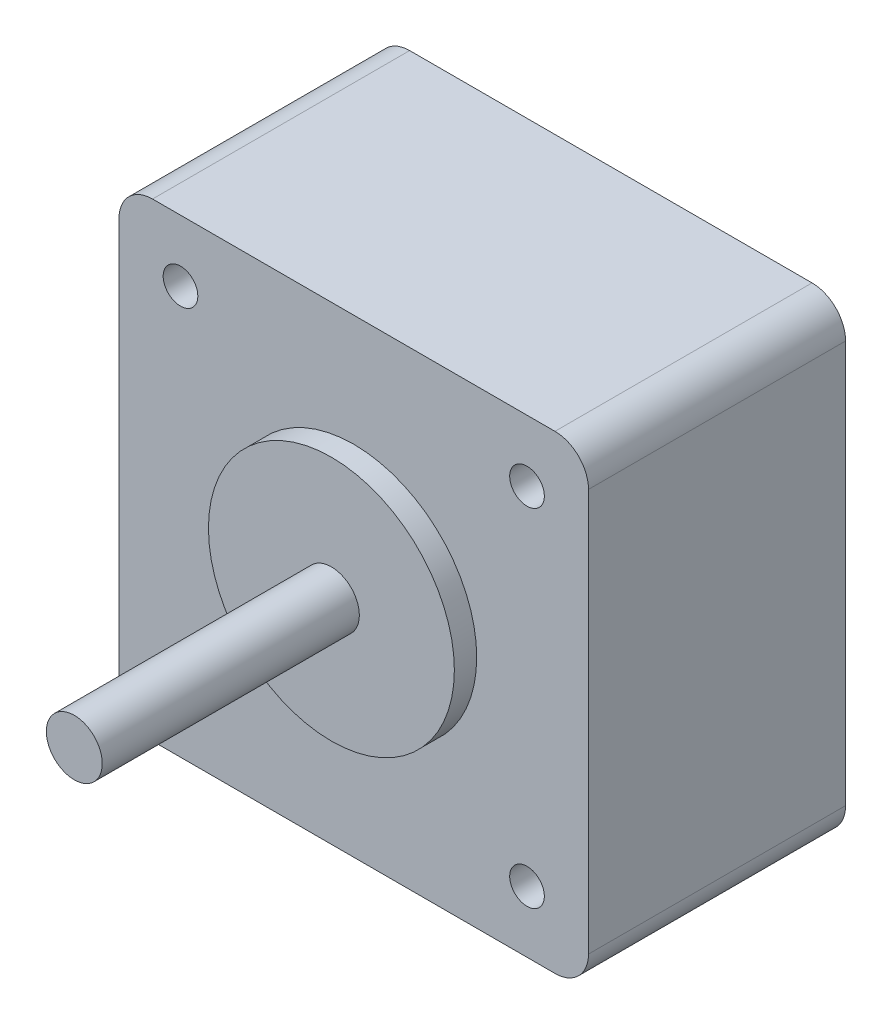
from build123d import *

# Parameters (mm, degrees)
EXTRUDE_1_DEPTH     = 23
SKETCH_2_R          = 11
EXTRUDE_2_DEPTH     = 2
SKETCH_3_R          = 2.5
EXTRUDE_3_DEPTH     = 23
SKETCH_4_R          = 1.55
CUT_EXTRUDE_1_DEPTH = 5


with BuildPart() as part:
    # 草图1 → 凸台-拉伸1 (new body)
    with BuildSketch(Plane.XY):
        with BuildLine():
            Line((-18, 21), (18, 21))
            ThreePointArc((18, 21), (20.121320344, 20.121320344), (21, 18))
            Line((21, 18), (21, -18))
            ThreePointArc((21, -18), (20.121320344, -20.121320344), (18, -21))
            Line((18, -21), (-18, -21))
            ThreePointArc((-18, -21), (-20.121320344, -20.121320344), (-21, -18))
            Line((-21, -18), (-21, 18))
            ThreePointArc((-21, 18), (-20.121320344, 20.121320344), (-18, 21))
        make_face()
    extrude(amount=EXTRUDE_1_DEPTH)

    # 草图2 → 凸台-拉伸2 (add)
    with BuildSketch(Plane.XY.offset(23)):
        Circle(SKETCH_2_R)
    extrude(amount=EXTRUDE_2_DEPTH)

    # 草图3 → 凸台-拉伸3 (add)
    with BuildSketch(Plane.XY.offset(25)):
        Circle(SKETCH_3_R)
    extrude(amount=EXTRUDE_3_DEPTH)

    # 草图4 → 切除-拉伸1 (cut)
    with BuildSketch(Plane.XY.offset(23)):
        with Locations((-15.5, 15.5)):
            Circle(SKETCH_4_R)
        with Locations((15.5, 15.5)):
            Circle(SKETCH_4_R)
        with Locations((15.5, -15.5)):
            Circle(SKETCH_4_R)
        with Locations((-15.5, -15.5)):
            Circle(SKETCH_4_R)
    extrude(amount=-CUT_EXTRUDE_1_DEPTH, mode=Mode.SUBTRACT)


solid = part.part
